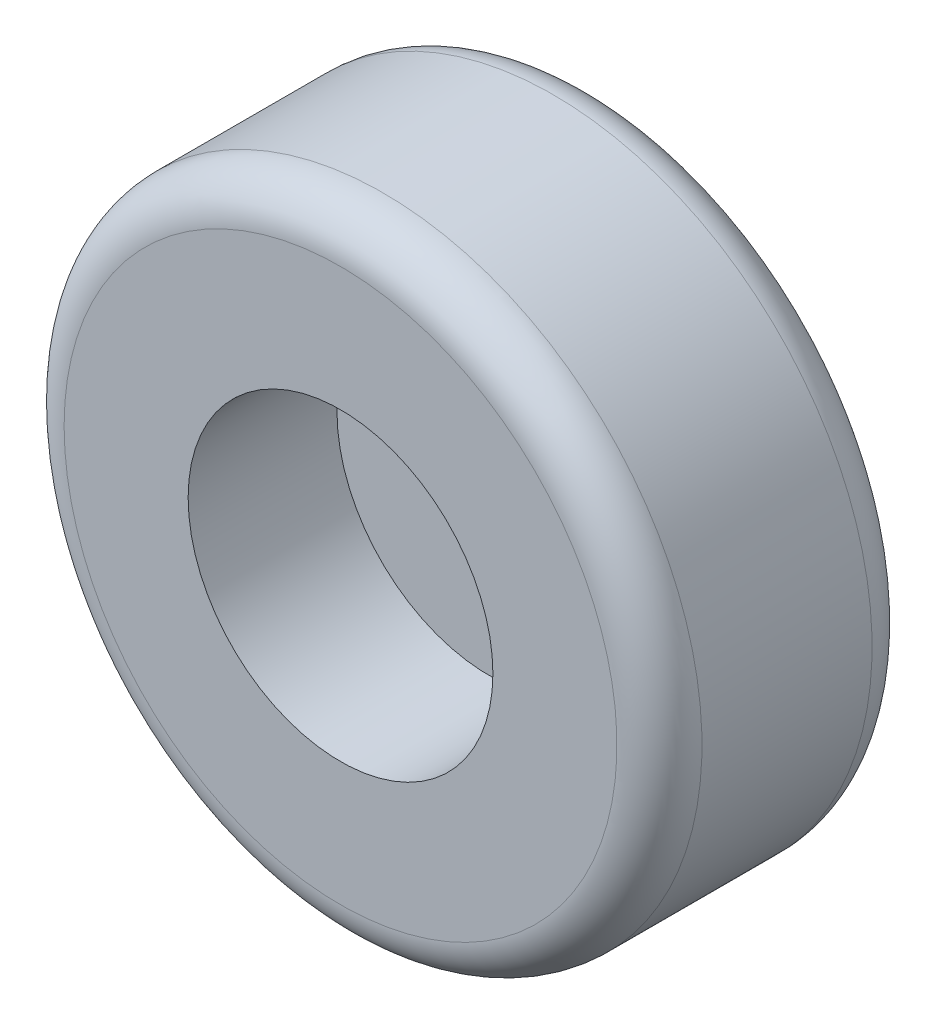
from build123d import *

# Parameters (mm, degrees)
CUT_EXTRUDE1_DEPTH = 37.558172882


with BuildPart() as part:
    # Sketch1 → Revolve1 (revolve)
    with BuildSketch(Plane(origin=(0, 0, 0), x_dir=(1, 0, 0), z_dir=(0, 1, 0))):
        with BuildLine():
            Line((0, 0), (19.5, 0))
            ThreePointArc((19.5, 0), (21.621320344, -0.878679656), (22.5, -3))
            Line((22.5, -3), (22.5, -15))
            ThreePointArc((22.5, -15), (21.621320344, -17.121320344), (19.5, -18))
            Line((19.5, -18), (10.75, -18))
            Line((10.75, -18), (10.75, -7.5))
            Line((10.75, -7.5), (0, -7.5))
            Line((0, -7.5), (0, 0))
        make_face()
    revolve(axis=Axis((0, 0, -41.848991251), (0, 0, 1)))

    # Sketch2 → Cut-Extrude1 (cut, through all)
    with BuildSketch(Plane.XY):
        with BuildLine():
            Line((-1.118033989, 1), (1.118033989, 1))
            ThreePointArc((1.118033989, 1), (0, -1.5), (-1.118033989, 1))
        make_face()
    extrude(amount=CUT_EXTRUDE1_DEPTH, mode=Mode.SUBTRACT)


solid = part.part
